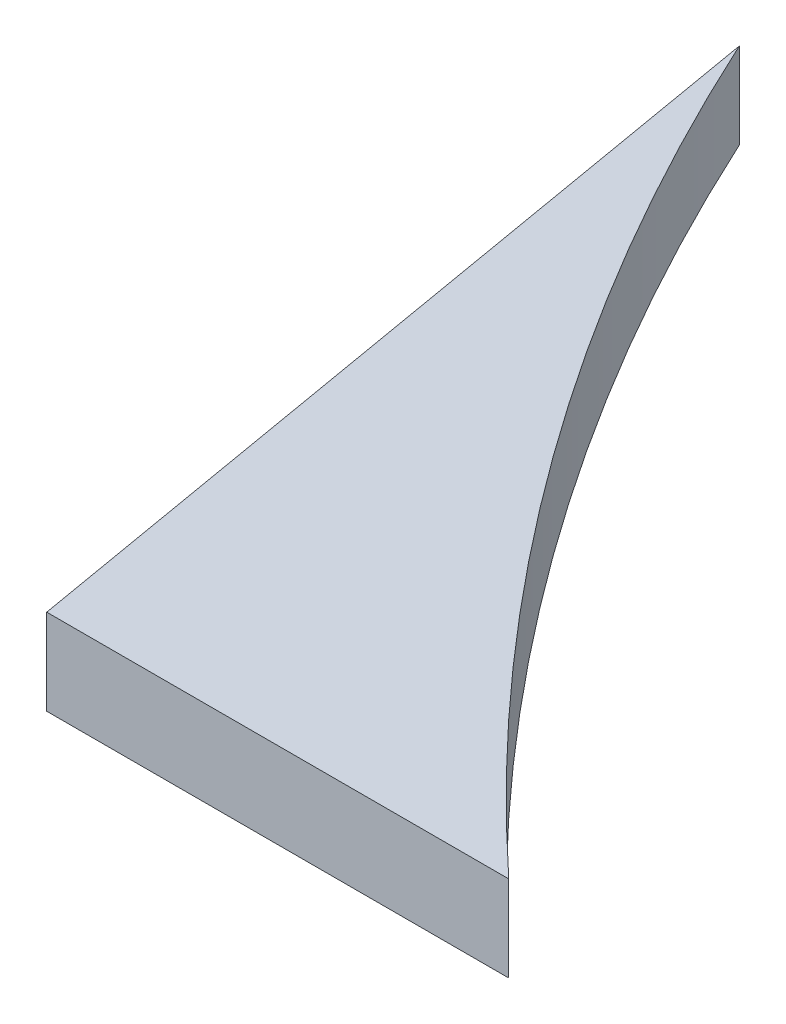
from build123d import *

# Parameters (mm, degrees)
EXTRUDE_1_DEPTH = 1


with BuildPart() as part:
    # 草图2 → 凸台-拉伸1 (new body)
    with BuildSketch(Plane(origin=(0, 0, 0), x_dir=(1, 0, 0), z_dir=(0, 1, 0))):
        with BuildLine():
            ThreePointArc((-28.157694818, -72.081145956), (-25.10492888, -77.300430792), (-21.097070242, -81.827834375))
            Line((-21.097070242, -81.827834375), (-26.479828457, -81.827834375))
            Line((-26.479828457, -81.827834375), (-28.157694818, -72.081145956))
        make_face()
    extrude(amount=EXTRUDE_1_DEPTH)


solid = part.part
